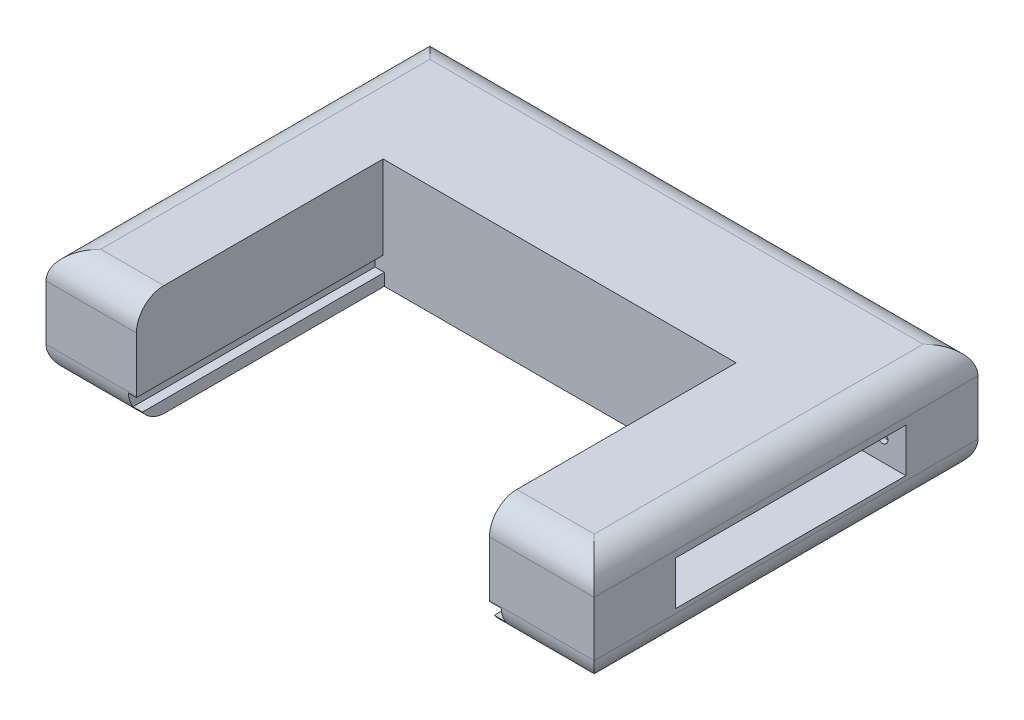
from build123d import *

# Parameters (mm, degrees)
SKETCH1_W           = 50
SKETCH1_H           = 35
BOSS_EXTRUDE1_DEPTH = 10
SKETCH2_W           = 34
SKETCH2_H           = 1.3
CUT_EXTRUDE1_DEPTH  = 22.5
SKETCH3_W           = 15
SKETCH3_H           = 7.598280995
CUT_EXTRUDE2_DEPTH  = 22.5
SKETCH4_W           = 17.2
SKETCH4_H           = 7.598280995
CUT_EXTRUDE3_DEPTH  = 22.5
SKETCH5_W           = 13.5
SKETCH5_H           = 1.101719005
CUT_EXTRUDE4_DEPTH  = 22.5
SKETCH6_W           = 18.6
SKETCH6_H           = 1.101719005
CUT_EXTRUDE5_DEPTH  = 22.5
SKETCH7_W           = 21
SKETCH7_H           = 4
CUT_EXTRUDE6_DEPTH  = 4
SKETCH8_R           = 0.5
CUT_EXTRUDE7_DEPTH  = 0.5
SKETCH9_R           = 0.5
CUT_EXTRUDE8_DEPTH  = 0.5
SKETCH10_W          = 21
SKETCH10_H          = 4
CUT_EXTRUDE9_DEPTH  = 4
SKETCH11_R          = 0.5
CUT_EXTRUDE10_DEPTH = 0.5
SKETCH12_R          = 0.5
CUT_EXTRUDE11_DEPTH = 0.5
FILLET1_R           = 2.5


with BuildPart() as part:
    # Sketch1 → Boss-Extrude1 (new body)
    with BuildSketch(Plane(origin=(0, 0, 0), x_dir=(1, 0, 0), z_dir=(0, 1, 0))):
        with Locations((-1.379996057, -3.323754789)):
            Rectangle(SKETCH1_W, SKETCH1_H)
    extrude(amount=BOSS_EXTRUDE1_DEPTH)

    # Sketch2 → Cut-Extrude1 (cut)
    with BuildSketch(Plane.XY.offset(20.823754789)):
        with Locations((-1.867795916, 1.751719005)):
            Rectangle(SKETCH2_W, SKETCH2_H)
    extrude(amount=-CUT_EXTRUDE1_DEPTH, mode=Mode.SUBTRACT)

    # Sketch3 → Cut-Extrude2 (cut)
    with BuildSketch(Plane.XY.offset(20.823754789)):
        with Locations((6.564825068, 6.200859503)):
            Rectangle(SKETCH3_W, SKETCH3_H)
    extrude(amount=-CUT_EXTRUDE2_DEPTH, mode=Mode.SUBTRACT)

    # Sketch4 → Cut-Extrude3 (cut)
    with BuildSketch(Plane.XY.offset(20.823754789)):
        with Locations((-9.535174932, 6.200859503)):
            Rectangle(SKETCH4_W, SKETCH4_H)
    extrude(amount=-CUT_EXTRUDE3_DEPTH, mode=Mode.SUBTRACT)

    # Sketch5 → Cut-Extrude4 (cut)
    with BuildSketch(Plane.XY.offset(20.823754789)):
        with Locations((7.329591682, 0.550859503)):
            Rectangle(SKETCH5_W, SKETCH5_H)
    extrude(amount=-CUT_EXTRUDE4_DEPTH, mode=Mode.SUBTRACT)

    # Sketch6 → Cut-Extrude5 (cut)
    with BuildSketch(Plane.XY.offset(20.823754789)):
        with Locations((-8.720408318, 0.550859503)):
            Rectangle(SKETCH6_W, SKETCH6_H)
    extrude(amount=-CUT_EXTRUDE5_DEPTH, mode=Mode.SUBTRACT)

    # Sketch7 → Cut-Extrude6 (cut)
    with BuildSketch(Plane.ZY.offset(26.379996057)):
        with Locations((3.348440288, 4.718765764)):
            Rectangle(SKETCH7_W, SKETCH7_H)
    extrude(amount=-CUT_EXTRUDE6_DEPTH, mode=Mode.SUBTRACT)

    # Sketch8 → Cut-Extrude7 (cut)
    with BuildSketch(Plane.XY.offset(-7.151559712)):
        with Locations((-24.165741094, 4.777186657)):
            Circle(SKETCH8_R)
    extrude(amount=-CUT_EXTRUDE7_DEPTH, mode=Mode.SUBTRACT)

    # Sketch9 → Cut-Extrude8 (cut)
    with BuildSketch(Plane(origin=(0, 0, 13.848440288), x_dir=(-1, 0, 0), z_dir=(0, 0, -1))):
        with Locations((24.247358315, 4.819765538)):
            Circle(SKETCH9_R)
    extrude(amount=-CUT_EXTRUDE8_DEPTH, mode=Mode.SUBTRACT)

    # Sketch10 → Cut-Extrude9 (cut)
    with BuildSketch(Plane(origin=(23.620003943, 0, 0), x_dir=(0, 0, -1), z_dir=(1, 0, 0))):
        with Locations((-2.904513536, 4.904491876)):
            Rectangle(SKETCH10_W, SKETCH10_H)
    extrude(amount=-CUT_EXTRUDE9_DEPTH, mode=Mode.SUBTRACT)

    # Sketch11 → Cut-Extrude10 (cut)
    with BuildSketch(Plane(origin=(0, 0, 13.404513536), x_dir=(-1, 0, 0), z_dir=(0, 0, -1))):
        with Locations((-21.490093602, 4.986179228)):
            Circle(SKETCH11_R)
    extrude(amount=-CUT_EXTRUDE10_DEPTH, mode=Mode.SUBTRACT)

    # Sketch12 → Cut-Extrude11 (cut)
    with BuildSketch(Plane.XY.offset(-7.595486464)):
        with Locations((21.482332732, 4.892682942)):
            Circle(SKETCH12_R)
    extrude(amount=-CUT_EXTRUDE11_DEPTH, mode=Mode.SUBTRACT)

    # Fillet1
    fillet1_edges = [part.edges().sort_by_distance(p)[0] for p in [
        (-22.200202188, 0, 20.823754789),
        (18.849797812, 0, 20.823754789),
        (-26.379996057, 0, 3.323754789),
        (-26.379996057, 10, 3.323754789),
        (-22.257585495, 10, 20.823754789),
        (18.842414505, 10, 20.823754789),
        (-1.379996057, 0, -14.176245211),
        (-1.379996057, 10, -14.176245211),
        (23.620003943, 0, 3.323754789),
        (23.620003943, 10, 3.323754789),
    ]]
    fillet(fillet1_edges, radius=FILLET1_R)


solid = part.part
